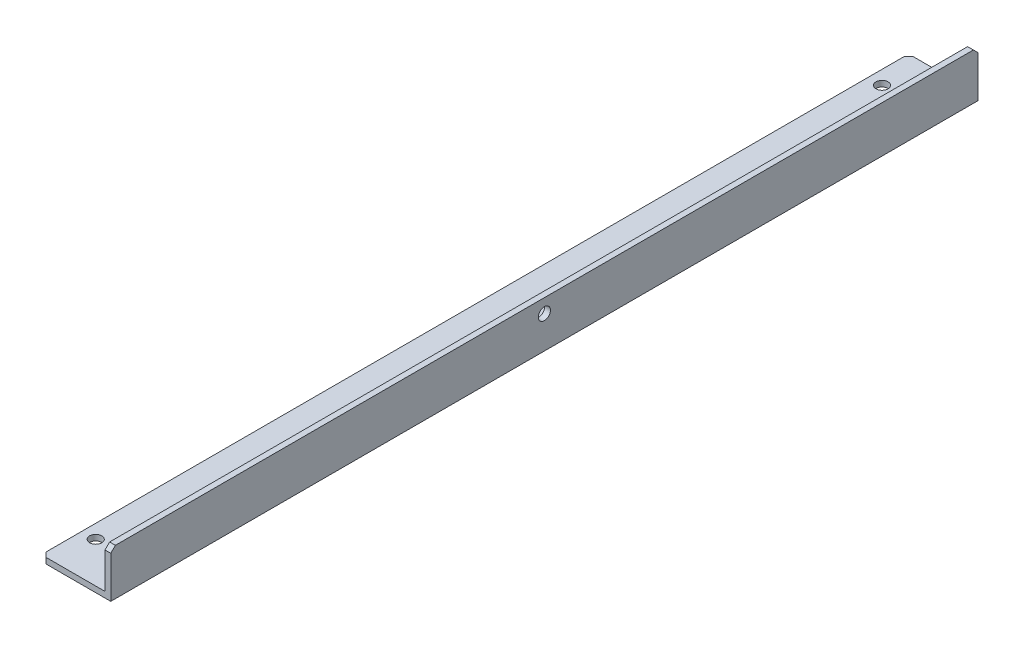
from build123d import *

# Parameters (mm, degrees)
BOSS_EXTRUDE1_DEPTH = 750
CUT_EXTRUDE1_REACH  = 755.21
SKETCH4_R           = 5.25
CUT_EXTRUDE2_REACH  = 755.077
SKETCH5_R           = 5.25
CHAMFER1_SIZE       = 4


with BuildPart() as part:
    # Sketch1 → Boss-Extrude1 (new body)
    with BuildSketch(Plane.XY):
        Polygon((0, 0), (-60, 0), (-60, 5), (-5, 5), (-5, 40), (0, 40), align=None)
    extrude(amount=BOSS_EXTRUDE1_DEPTH)

    # Sketch4 → Cut-Extrude1 (cut, up to next)
    with BuildSketch(Plane(origin=(0, 5, 0), x_dir=(1, 0, 0), z_dir=(0, 1, 0)), mode=Mode.PRIVATE) as cut_extrude1_sk1:
        with Locations(Location((-48, -35, 0), (0, 0, 270))):
            Circle(SKETCH4_R)
    cut_extrude1_tool1 = extrude(cut_extrude1_sk1.sketch, amount=-CUT_EXTRUDE1_REACH, mode=Mode.PRIVATE) & part.part
    # Sketch4 → Cut-Extrude1 (cut, up to next)
    with BuildSketch(Plane(origin=(0, 5, 0), x_dir=(1, 0, 0), z_dir=(0, 1, 0)), mode=Mode.PRIVATE) as cut_extrude1_sk2:
        with Locations(Location((-48, -715, 0), (0, 0, 180))):
            Circle(SKETCH4_R)
    cut_extrude1_tool2 = extrude(cut_extrude1_sk2.sketch, amount=-CUT_EXTRUDE1_REACH, mode=Mode.PRIVATE) & part.part
    add(cut_extrude1_tool1.solids().sort_by_distance((-48, 5, 35))[0], mode=Mode.SUBTRACT)
    add(cut_extrude1_tool2.solids().sort_by_distance((-48, 5, 715))[0], mode=Mode.SUBTRACT)

    # Sketch5 → Cut-Extrude2 (cut, up to next)
    with BuildSketch(Plane.ZY.offset(5), mode=Mode.PRIVATE) as cut_extrude2_sk1:
        with Locations(Location((375, 28, 0), (0, 0, 270))):
            Circle(SKETCH5_R)
    cut_extrude2_tool1 = extrude(cut_extrude2_sk1.sketch, amount=-CUT_EXTRUDE2_REACH, mode=Mode.PRIVATE) & part.part
    add(cut_extrude2_tool1.solids().sort_by_distance((-5, 28, 375))[0], mode=Mode.SUBTRACT)

    # Chamfer1
    chamfer1_edges = [part.edges().sort_by_distance(p)[0] for p in [
        (-60, 2.5, 750),
        (-60, 2.5, 0),
        (-2.5, 40, 750),
        (-2.5, 40, 0),
    ]]
    chamfer(chamfer1_edges, length=CHAMFER1_SIZE)


solid = part.part
